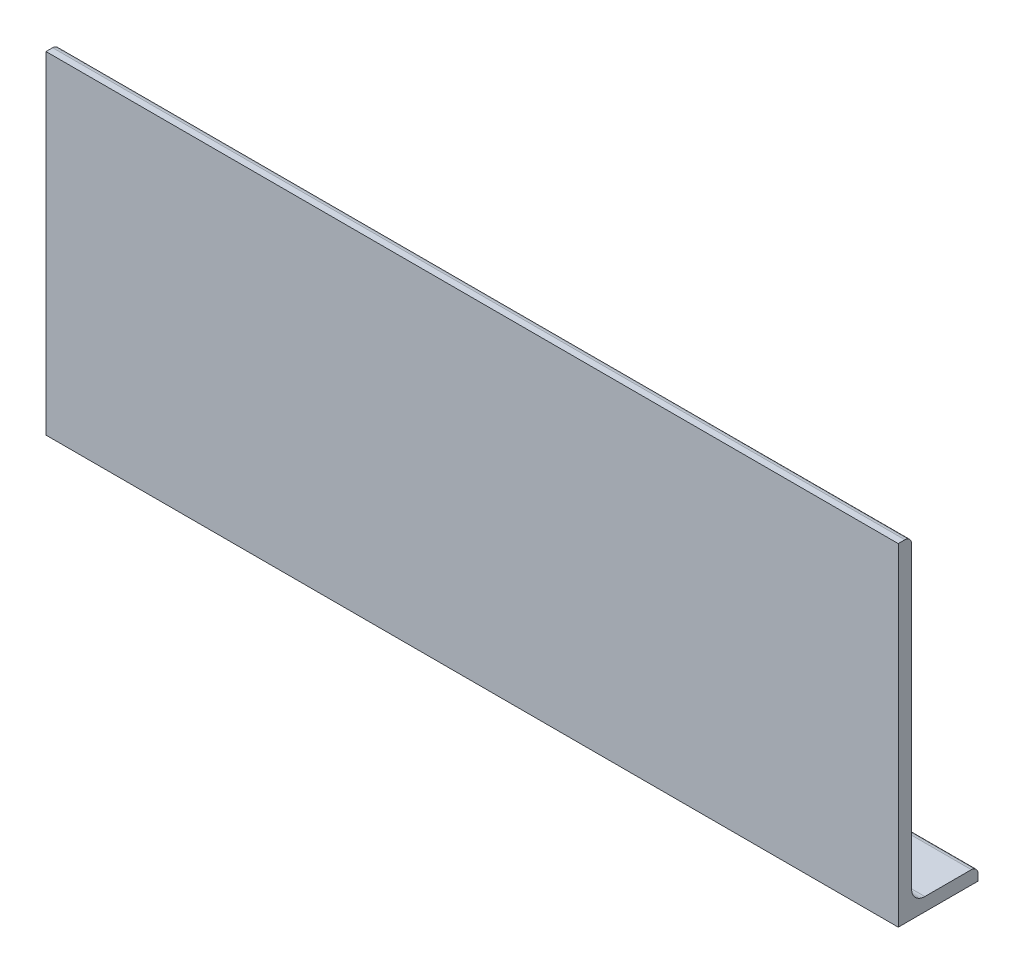
from build123d import *

# Parameters (mm, degrees)
BOSS_EXTRUDE1_DEPTH = 128.27
FILLET1_R           = 1
FILLET2_R           = 2
SKETCH2_R           = 1.6
CUT_EXTRUDE1_DEPTH  = 188.253444223


with BuildPart() as part:
    # Sketch1 → Boss-Extrude1 (new body)
    with BuildSketch(Plane(origin=(0, 0, 0), x_dir=(0, 0, -1), z_dir=(1, 0, 0))):
        Polygon((-127.697531195, -39.21530097), (-127.697531195, -89.21530097), (-115.697531195, -89.21530097), (-115.697531195, -87.21530097), (-125.697531195, -87.21530097), (-125.697531195, -39.21530097), align=None)
    extrude(amount=BOSS_EXTRUDE1_DEPTH)

    # Fillet1
    fillet1_edges = [part.edges().sort_by_distance(p)[0] for p in [
        (64.135, -39.21530097, 125.697531195),
        (64.135, -87.21530097, 115.697531195),
    ]]
    fillet(fillet1_edges, radius=FILLET1_R)

    # Fillet2
    fillet2_edges = [part.edges().sort_by_distance(p)[0] for p in [
        (64.135, -87.21530097, 125.697531195),
    ]]
    fillet(fillet2_edges, radius=FILLET2_R)

    # Sketch2 → Cut-Extrude1 (cut, through all)
    with BuildSketch(Plane(origin=(0, -87.21530097, 0), x_dir=(1, 0, 0), z_dir=(0, 1, 0))):
        with Locations(Location((20, -120.197531195, 0), (0, 0, 270))):
            Circle(SKETCH2_R)
        with Locations(Location((108.27, -120.197531195, 0), (0, 0, 270))):
            Circle(SKETCH2_R)
    extrude(amount=-CUT_EXTRUDE1_DEPTH, mode=Mode.SUBTRACT)


solid = part.part
